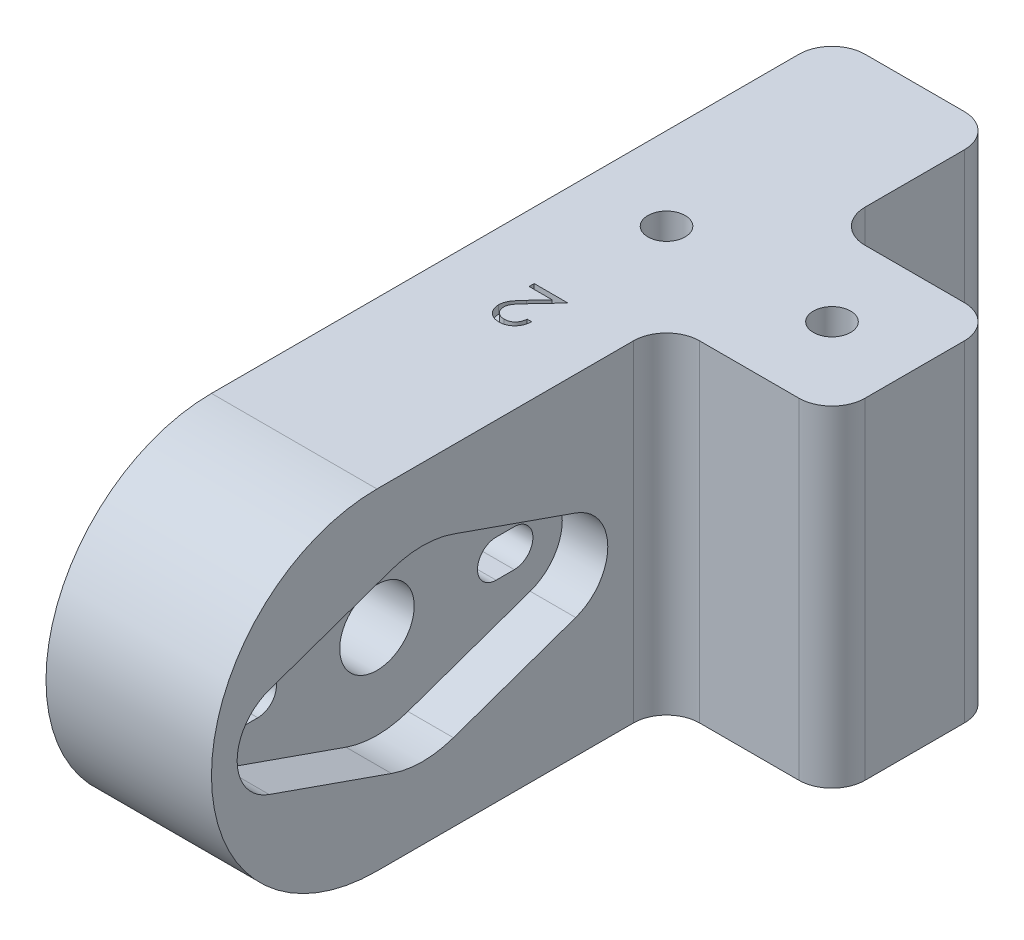
from build123d import *

# Parameters (mm, degrees)
SALIENTE_EXTRUIR1_DEPTH = 40
CORTAR_EXTRUIR1_REACH   = 71.282
CROQUIS2_R              = 2.25
SALIENTE_EXTRUIR2_DEPTH = 20
CROQUIS5_R              = 4.15
CORTAR_EXTRUIR2_DEPTH   = 25
REDONDEO2_R             = 4
CORTAR_EXTRUIR3_REACH   = 72.887
CROQUIS10_R             = 4.5
CROQUIS10_R_2           = 2.25
CORTAR_EXTRUIR5_START   = -20
CORTAR_EXTRUIR5_DEPTH   = 20
CORTAR_EXTRUIR6_DEPTH   = 5.5
CORTAR_EXTRUIR7_DEPTH   = 1


with BuildPart() as part:
    # Croquis1 → Saliente-Extruir1 (new body)
    with BuildSketch(Plane(origin=(0, 0, 0), x_dir=(1, 0, 0), z_dir=(0, 1, 0))):
        Polygon((0, 0), (40, 0), (40, 20), (20, 20), (20, 40), (0, 40), align=None)
    extrude(amount=SALIENTE_EXTRUIR1_DEPTH)

    # Croquis2 → Cortar-Extruir1 (cut, up to next)
    with BuildSketch(Plane(origin=(0, 40, 0), x_dir=(1, 0, 0), z_dir=(0, 1, 0)), mode=Mode.PRIVATE) as cortar_extruir1_sk1:
        with Locations(Location((30, 10, 0), (0, 0, 270))):
            Circle(CROQUIS2_R)
    cortar_extruir1_tool1 = extrude(cortar_extruir1_sk1.sketch, amount=-CORTAR_EXTRUIR1_REACH, mode=Mode.PRIVATE) & part.part
    # Croquis2 → Cortar-Extruir1 (cut, up to next)
    with BuildSketch(Plane(origin=(0, 40, 0), x_dir=(1, 0, 0), z_dir=(0, 1, 0)), mode=Mode.PRIVATE) as cortar_extruir1_sk2:
        with Locations(Location((10, 10, 0), (0, 0, 270))):
            Circle(CROQUIS2_R)
    cortar_extruir1_tool2 = extrude(cortar_extruir1_sk2.sketch, amount=-CORTAR_EXTRUIR1_REACH, mode=Mode.PRIVATE) & part.part
    add(cortar_extruir1_tool1.solids().sort_by_distance((30, 40, -10))[0], mode=Mode.SUBTRACT)
    add(cortar_extruir1_tool2.solids().sort_by_distance((10, 40, -10))[0], mode=Mode.SUBTRACT)

    # Croquis3 → Saliente-Extruir2 (add)
    with BuildSketch(Plane.ZY):
        with BuildLine():
            Line((35, 40), (0, 40))
            Line((0, 40), (0, 0))
            Line((0, 0), (35, 0))
            ThreePointArc((35, 0), (55, 20), (35, 40))
        make_face()
    extrude(amount=-SALIENTE_EXTRUIR2_DEPTH)

    # Croquis5 → Cortar-Extruir2 (cut)
    with BuildSketch(Plane(origin=(0, 0, -40), x_dir=(-1, 0, 0), z_dir=(0, 0, -1))):
        with Locations((-10, 30)):
            Circle(CROQUIS5_R)
    extrude(amount=-CORTAR_EXTRUIR2_DEPTH, mode=Mode.SUBTRACT)

    # Redondeo2
    redondeo2_edges = [part.edges().sort_by_distance(p)[0] for p in [
        (0, 20, -40),
        (20, 20, -40),
        (20, 20, -20),
        (40, 20, -20),
        (40, 20, 0),
        (20, 20, 0),
    ]]
    fillet(redondeo2_edges, radius=REDONDEO2_R)

    # Croquis10 → Cortar-Extruir3 (cut, up to next)
    with BuildSketch(Plane(origin=(20, 0, 0), x_dir=(0, 0, -1), z_dir=(1, 0, 0)), mode=Mode.PRIVATE) as cortar_extruir3_sk1:
        with Locations((-29.5, 20)):
            Circle(CROQUIS10_R)
    cortar_extruir3_tool1 = extrude(cortar_extruir3_sk1.sketch, amount=-CORTAR_EXTRUIR3_REACH, mode=Mode.PRIVATE) & part.part
    # Croquis10 → Cortar-Extruir3 (cut, up to next)
    with BuildSketch(Plane(origin=(20, 0, 0), x_dir=(0, 0, -1), z_dir=(1, 0, 0)), mode=Mode.PRIVATE) as cortar_extruir3_sk2:
        with Locations((-14, 20)):
            Circle(CROQUIS10_R_2)
    cortar_extruir3_tool2 = extrude(cortar_extruir3_sk2.sketch, amount=-CORTAR_EXTRUIR3_REACH, mode=Mode.PRIVATE) & part.part
    # Croquis10 → Cortar-Extruir3 (cut, up to next)
    with BuildSketch(Plane(origin=(20, 0, 0), x_dir=(0, 0, -1), z_dir=(1, 0, 0)), mode=Mode.PRIVATE) as cortar_extruir3_sk3:
        with Locations((-45, 20)):
            Circle(CROQUIS10_R_2)
    cortar_extruir3_tool3 = extrude(cortar_extruir3_sk3.sketch, amount=-CORTAR_EXTRUIR3_REACH, mode=Mode.PRIVATE) & part.part
    add(cortar_extruir3_tool1.solids().sort_by_distance((20, 20, 29.5))[0], mode=Mode.SUBTRACT)
    add(cortar_extruir3_tool2.solids().sort_by_distance((20, 20, 14))[0], mode=Mode.SUBTRACT)
    add(cortar_extruir3_tool3.solids().sort_by_distance((20, 20, 45))[0], mode=Mode.SUBTRACT)

    # Croquis12 → Cortar-Extruir5 (cut)
    with BuildSketch(Plane(origin=(20, 0, 0), x_dir=(0, 0, -1), z_dir=(1, 0, 0)).offset(CORTAR_EXTRUIR5_START)):
        with BuildLine():
            Line((-15.1, 22.25), (-12.9, 22.25))
            ThreePointArc((-12.9, 22.25), (-10.65, 20), (-12.9, 17.75))
            Line((-12.9, 17.75), (-15.1, 17.75))
            ThreePointArc((-15.1, 17.75), (-17.35, 20), (-15.1, 22.25))
        make_face()
        with BuildLine():
            Line((-43.9, 17.75), (-46.1, 17.75))
            ThreePointArc((-46.1, 17.75), (-48.35, 20), (-46.1, 22.25))
            Line((-46.1, 22.25), (-43.9, 22.25))
            ThreePointArc((-43.9, 22.25), (-41.65, 20), (-43.9, 17.75))
        make_face()
    extrude(amount=CORTAR_EXTRUIR5_DEPTH, mode=Mode.SUBTRACT)

    # Croquis14 → Cortar-Extruir6 (cut)
    with BuildSketch(Plane(origin=(20, 0, 0), x_dir=(0, 0, -1), z_dir=(1, 0, 0))):
        with BuildLine():
            Line((-48.021686747, 25.472396189), (-33.243975904, 30.661737402))
            ThreePointArc((-33.243975904, 30.661737402), (-29.5, 31.3), (-25.756024096, 30.661737402))
            Line((-25.756024096, 30.661737402), (-10.978313253, 25.472396189))
            ThreePointArc((-10.978313253, 25.472396189), (-7.1, 20), (-10.978313253, 14.527603811))
            Line((-10.978313253, 14.527603811), (-25.756024096, 9.338262598))
            ThreePointArc((-25.756024096, 9.338262598), (-29.5, 8.7), (-33.243975904, 9.338262598))
            Line((-33.243975904, 9.338262598), (-48.021686747, 14.527603811))
            ThreePointArc((-48.021686747, 14.527603811), (-51.9, 20), (-48.021686747, 25.472396189))
        make_face()
    extrude(amount=-CORTAR_EXTRUIR6_DEPTH, mode=Mode.SUBTRACT)

    # Croquis15 → Cortar-Extruir7 (cut)
    with BuildSketch(Plane(origin=(0, 40, 0), x_dir=(1, 0, 0), z_dir=(0, 1, 0))):
        with BuildLine():
            Line((11.307692308, -8.153846154), (11.846153846, -8.153846154))
            add(Edge.make_bspline(
                [(11.846153846, -8.153846154), (11.842645038, -8.225282314), (11.835753833, -8.36558103), (11.803468313, -8.570131316), (11.757314544, -8.765671861), (11.691903885, -8.950526266), (11.611127437, -9.126902771), (11.512233689, -9.292459299), (11.397330895, -9.448838982), (11.266629849, -9.593081031), (11.124807169, -9.724936298), (10.972712592, -9.840005009), (10.811909364, -9.936114468), (10.643792222, -10.016896686), (10.466416843, -10.077459923), (10.281478736, -10.12241659), (10.088142, -10.149460313), (9.956416396, -10.152367573), (9.889423077, -10.153846154)],
                knots=[0, 0, 0, 0, 1.100776268, 2.161895295, 3.184016182, 4.190939212, 5.176500551, 6.166955529, 7.155448256, 8.160289653, 9.16017456, 10.133824356, 11.091467644, 12.04088621, 13.000931625, 13.972173743, 14.968683325, 16, 16, 16, 16], degree=3))
            add(Edge.make_bspline(
                [(9.889423077, -10.153846154), (9.823627463, -10.152318442), (9.694341431, -10.149316542), (9.50572919, -10.123149389), (9.325747878, -10.08305056), (9.15643722, -10.023630413), (8.996059613, -9.949071125), (8.846600799, -9.856346883), (8.704446708, -9.749845084), (8.576574014, -9.62422099), (8.459107518, -9.490179765), (8.357858501, -9.347024863), (8.270662051, -9.198998287), (8.19929448, -9.044943733), (8.145194688, -8.884359526), (8.105111926, -8.71878524), (8.082198454, -8.546310036), (8.078701137, -8.429552583), (8.076923077, -8.370192308)],
                knots=[0, 0, 0, 0, 1.111674182, 2.184400057, 3.212814286, 4.223731311, 5.211378316, 6.196328225, 7.191884489, 8.207283132, 9.220262353, 10.201199469, 11.166417575, 12.120932471, 13.06540007, 14.026332106, 14.996573967, 16, 16, 16, 16], degree=3))
            add(Edge.make_bspline(
                [(8.076923077, -8.370192308), (8.079825859, -8.286624627), (8.085580483, -8.120955761), (8.13480446, -7.877501183), (8.211686738, -7.641628758), (8.304245432, -7.451786912), (8.397645126, -7.298829691), (8.481727628, -7.172830092), (8.580719899, -7.037198101), (8.693776191, -6.891384748), (8.822843495, -6.737299583), (8.964568659, -6.571798854), (9.122611785, -6.397942783), (9.233438011, -6.279119385), (9.290865385, -6.217548077)],
                knots=[0, 0, 0, 0, 1.184416499, 2.348048165, 3.509039915, 4.696071444, 5.333504901, 6.05069495, 6.844171097, 7.714965912, 8.667477798, 9.695072654, 10.805644396, 12, 12, 12, 12], degree=3))
            Line((9.290865385, -6.217548077), (10.792067308, -4.615384615))
            Line((10.792067308, -4.615384615), (8, -4.615384615))
            Line((8, -4.615384615), (8, -4))
            Line((8, -4), (12.076923077, -4))
            Line((12.076923077, -4), (9.75, -6.483173077))
            add(Edge.make_bspline(
                [(9.75, -6.483173077), (9.693342469, -6.542309805), (9.584514946, -6.655899358), (9.430654729, -6.82178687), (9.292241226, -6.975502303), (9.169182624, -7.117726807), (9.061377669, -7.2476541), (8.969171289, -7.366302394), (8.892155948, -7.472653483), (8.810535736, -7.597590295), (8.732705448, -7.750311776), (8.664300588, -7.936006624), (8.622889216, -8.127587641), (8.617896164, -8.257013212), (8.615384615, -8.322115385)],
                knots=[0, 0, 0, 0, 1.329530082, 2.553755191, 3.672934919, 4.687409497, 5.60679272, 6.413407421, 7.126401618, 7.737995624, 8.834647426, 9.90044882, 10.943907757, 12, 12, 12, 12], degree=3))
            add(Edge.make_bspline(
                [(8.615384615, -8.322115385), (8.616463264, -8.363059449), (8.618589075, -8.443752337), (8.637705753, -8.561983012), (8.665791949, -8.676472493), (8.709081452, -8.7858052), (8.761092196, -8.892131494), (8.827539757, -8.992218726), (8.903471871, -9.089478629), (8.991549398, -9.180576241), (9.088242157, -9.264035799), (9.190407045, -9.337961219), (9.298492072, -9.399742965), (9.4120468, -9.45038885), (9.530753256, -9.490118105), (9.654841407, -9.51764709), (9.783968288, -9.53493135), (9.872139995, -9.53726993), (9.917067308, -9.538461538)],
                knots=[0, 0, 0, 0, 0.991504627, 1.954065223, 2.895985987, 3.842598665, 4.797835564, 5.759220273, 6.74786863, 7.784730864, 8.824135544, 9.839918996, 10.835834653, 11.835434876, 12.84861661, 13.863796685, 14.911511676, 16, 16, 16, 16], degree=3))
            add(Edge.make_bspline(
                [(9.917067308, -9.538461538), (9.964000721, -9.537284508), (10.056170195, -9.534973014), (10.191204591, -9.5174538), (10.320924626, -9.490921844), (10.443331351, -9.448683187), (10.560986519, -9.399248357), (10.67088869, -9.335238949), (10.776125151, -9.262098301), (10.874580094, -9.17682095), (10.964251271, -9.080555667), (11.045825943, -8.975772607), (11.114944972, -8.860614179), (11.176301237, -8.737843643), (11.223226665, -8.604087986), (11.263344544, -8.462618365), (11.29248559, -8.311416341), (11.302539212, -8.20724191), (11.307692308, -8.153846154)],
                knots=[0, 0, 0, 0, 1.031072318, 2.024855787, 2.988461151, 3.935103592, 4.865765533, 5.788564469, 6.724086513, 7.67908574, 8.64457978, 9.611397706, 10.591395687, 11.591555111, 12.622101007, 13.700900657, 14.821571223, 16, 16, 16, 16], degree=3))
        make_face()
    extrude(amount=-CORTAR_EXTRUIR7_DEPTH, mode=Mode.SUBTRACT)


solid = part.part
